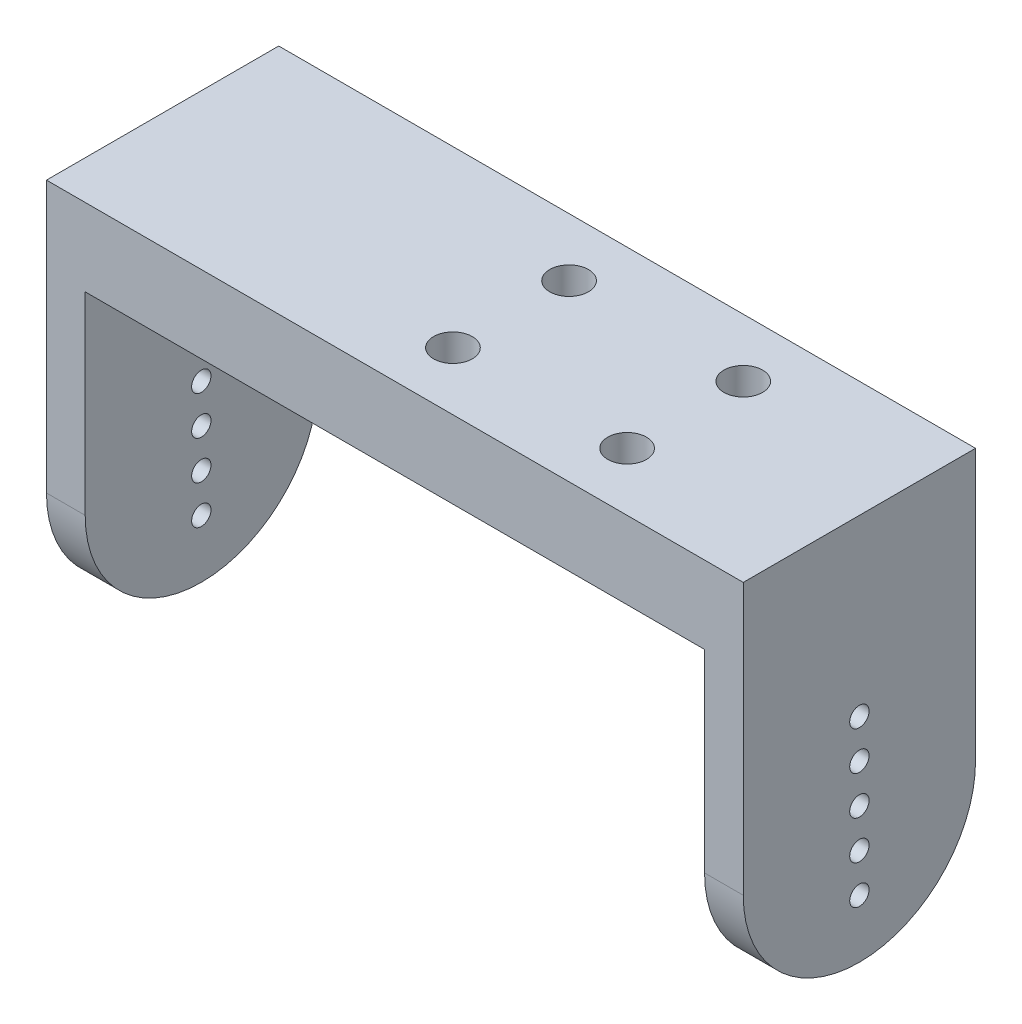
from build123d import *

# Parameters (mm, degrees)
SKETCH1_W           = 36
SKETCH1_H           = 20
BOSS_EXTRUDE1_DEPTH = 12
SKETCH3_W           = 32
SKETCH3_H           = 16
CUT_EXTRUDE1_DEPTH  = 12
SKETCH4_W           = 32
SKETCH4_H           = 12
CUT_EXTRUDE2_DEPTH  = 12
CUT_EXTRUDE3_DEPTH  = 40.242833741
SKETCH5_R           = 1
CUT_EXTRUDE4_DEPTH  = 10
SKETCH6_R           = 0.5
CUT_EXTRUDE5_DEPTH  = 40.242833741
SKETCH7_W           = 32
SKETCH7_H           = 1
BOSS_EXTRUDE2_DEPTH = 2


with BuildPart() as part:
    # Sketch1 → Boss-Extrude1 (new body)
    with BuildSketch(Plane.XY):
        Rectangle(SKETCH1_W, SKETCH1_H)
    extrude(amount=BOSS_EXTRUDE1_DEPTH)

    # Sketch3 → Cut-Extrude1 (cut)
    with BuildSketch(Plane.XY.offset(12)):
        Rectangle(SKETCH3_W, SKETCH3_H)
    extrude(amount=-CUT_EXTRUDE1_DEPTH, mode=Mode.SUBTRACT)

    # Sketch4 → Cut-Extrude2 (cut)
    with BuildSketch(Plane(origin=(0, -8, 0), x_dir=(1, 0, 0), z_dir=(0, 1, 0))):
        with Locations((0, -6)):
            Rectangle(SKETCH4_W, SKETCH4_H)
    extrude(amount=-CUT_EXTRUDE2_DEPTH, mode=Mode.SUBTRACT)

    # Sketch2 → Cut-Extrude3 (cut, through all)
    with BuildSketch(Plane(origin=(18, 0, 0), x_dir=(0, 0, -1), z_dir=(1, 0, 0))):
        with BuildLine():
            Line((-12, -10), (-6, -10))
            ThreePointArc((-6, -10), (-10.242640687, -8.242640687), (-12, -4))
            Line((-12, -4), (-12, -10))
        make_face()
        with BuildLine():
            Line((-6, -10), (0, -10))
            Line((0, -10), (0, -4))
            ThreePointArc((0, -4), (-1.757359313, -8.242640687), (-6, -10))
        make_face()
    extrude(amount=-CUT_EXTRUDE3_DEPTH, mode=Mode.SUBTRACT)

    # Sketch5 → Cut-Extrude4 (cut)
    with BuildSketch(Plane(origin=(0, 10, 0), x_dir=(1, 0, 0), z_dir=(0, 1, 0))):
        with Locations(Location((9, -3, 0), (0, 0, 270))):
            Circle(SKETCH5_R)
        with Locations(Location((9, -9, 0), (0, 0, 180))):
            Circle(SKETCH5_R)
        with Locations(Location((0, -9, 0), (0, 0, 180))):
            Circle(SKETCH5_R)
        with Locations(Location((0, -3, 0), (0, 0, 270))):
            Circle(SKETCH5_R)
    extrude(amount=-CUT_EXTRUDE4_DEPTH, mode=Mode.SUBTRACT)

    # Sketch6 → Cut-Extrude5 (cut, through all)
    with BuildSketch(Plane(origin=(18, 0, 0), x_dir=(0, 0, -1), z_dir=(1, 0, 0))):
        with Locations((-6, -7)):
            Circle(SKETCH6_R)
        with Locations((-6, -5)):
            Circle(SKETCH6_R)
        with Locations((-6, -3)):
            Circle(SKETCH6_R)
        with Locations((-6, -1)):
            Circle(SKETCH6_R)
        with Locations((-6, 1)):
            Circle(SKETCH6_R)
    extrude(amount=-CUT_EXTRUDE5_DEPTH, mode=Mode.SUBTRACT)

    # Sketch7 → Boss-Extrude2 (add)
    with BuildSketch(Plane.XZ.offset(-8)):
        with Locations((0, 11.5)):
            Rectangle(SKETCH7_W, SKETCH7_H)
        with Locations((0, 0.5)):
            Rectangle(SKETCH7_W, SKETCH7_H)
    extrude(amount=BOSS_EXTRUDE2_DEPTH)


solid = part.part
